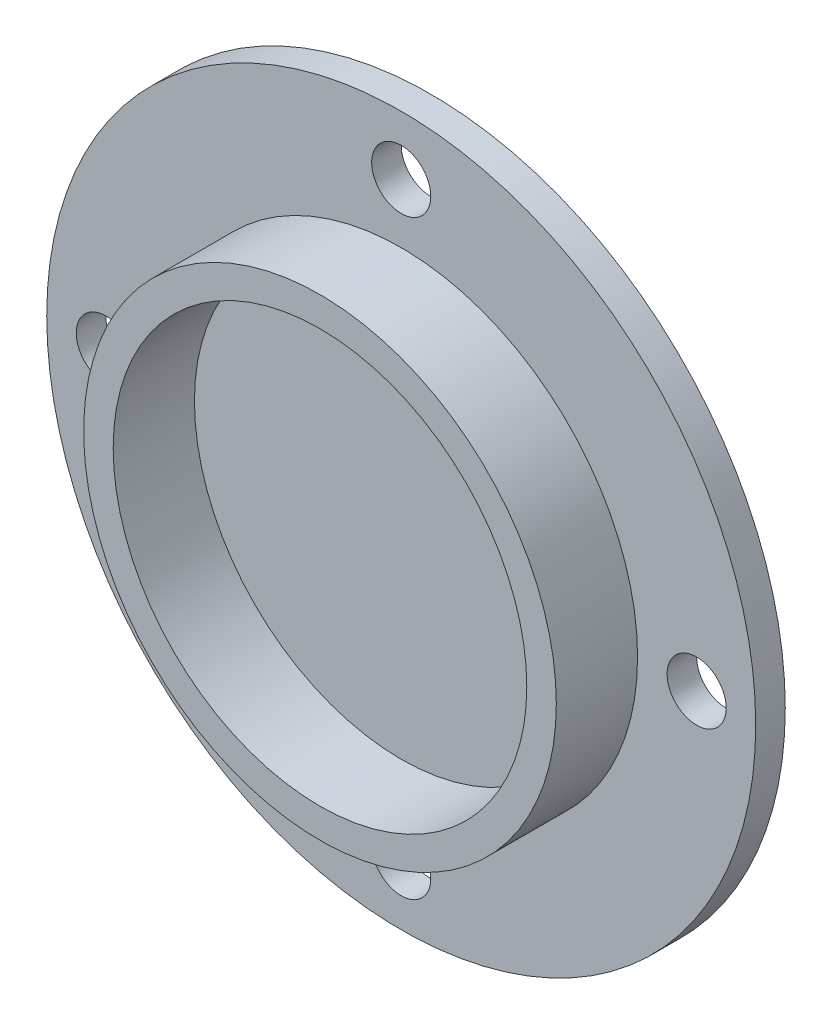
from build123d import *

# Parameters (mm, degrees)
SKETCH_1_R      = 120
SKETCH_1_R_2    = 10
EXTRUDE_1_DEPTH = 10
SKETCH_2_R      = 80
SKETCH_2_R_2    = 70
EXTRUDE_2_DEPTH = 27.5


with BuildPart() as part:
    # 草图1 → 拉伸1 (new body)
    with BuildSketch(Plane.XY):
        Circle(SKETCH_1_R)
        with Locations((0, 100)):
            Circle(SKETCH_1_R_2, mode=Mode.SUBTRACT)
        with Locations((-100, 0)):
            Circle(SKETCH_1_R_2, mode=Mode.SUBTRACT)
        with Locations((100, 0)):
            Circle(SKETCH_1_R_2, mode=Mode.SUBTRACT)
        with Locations((0, -100)):
            Circle(SKETCH_1_R_2, mode=Mode.SUBTRACT)
    extrude(amount=EXTRUDE_1_DEPTH)

    # 草图2 → 拉伸2 (add)
    with BuildSketch(Plane.XY.offset(10)):
        Circle(SKETCH_2_R)
        Circle(SKETCH_2_R_2, mode=Mode.SUBTRACT)
    extrude(amount=EXTRUDE_2_DEPTH)


solid = part.part
